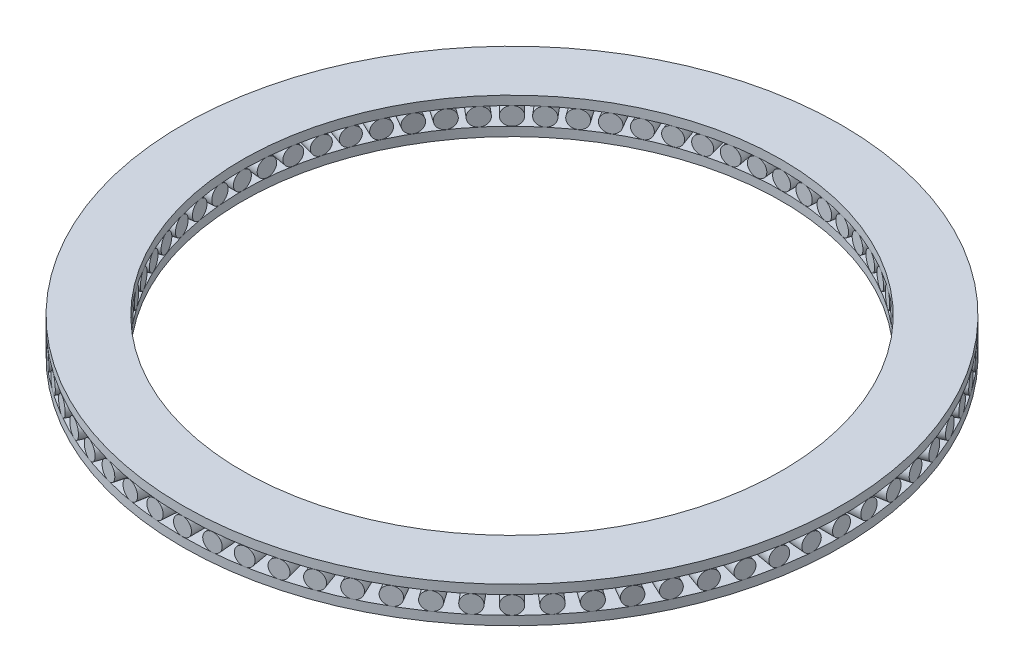
from build123d import *

# Parameters (mm, degrees)
SKETCH_1_R               = 55
SKETCH_1_R_2             = 45
EXTRUDE_1_DEPTH          = 1.5
EXTRUDE_START            = 45
SKETCH_2_R               = 1.5
EXTRUDE_2_DEPTH          = 10
PATTERN_CIRCULAR_3_COUNT = 72
EXTRUDE_START_2          = -4.5
SKETCH_3_R               = 55
SKETCH_3_R_2             = 45
EXTRUDE_3_DEPTH          = 1.5


with BuildPart() as part:
    # 草图1 → 凸台-拉伸1 (new body)
    with BuildSketch(Plane(origin=(0, 0, 0), x_dir=(1, 0, 0), z_dir=(0, 1, 0))):
        with Locations(Location((0, 0, 0), (0, 0, 270))):
            Circle(SKETCH_1_R)
        with Locations(Location((0, 0, 0), (0, 0, 270))):
            Circle(SKETCH_1_R_2, mode=Mode.SUBTRACT)
    extrude(amount=EXTRUDE_1_DEPTH)


with BuildPart() as body_2:
    # 草图2 → 凸台-拉伸2 (new body)
    with BuildSketch(Plane.XY.offset(EXTRUDE_START)):
        with Locations((0, 3)):
            Circle(SKETCH_2_R)
    extrude(amount=EXTRUDE_2_DEPTH)

    # 阵列(圆周)3: body 2 ×72 about axis
    pattern_circular_3_axis = Axis((0, 0, 0), (0, 1, 0))


with BuildPart() as body_2_1:
    add(body_2.part)
    for i in range(1, PATTERN_CIRCULAR_3_COUNT):
        add(body_2.part.rotate(pattern_circular_3_axis, i * 360 / PATTERN_CIRCULAR_3_COUNT))


with BuildPart() as body_3:
    # 草图3 → 凸台-拉伸3 (new body)
    with BuildSketch(Plane.XZ.offset(EXTRUDE_START_2)):
        with Locations(Location((0, 0, 0), (0, 0, 270))):
            Circle(SKETCH_3_R)
        with Locations(Location((0, 0, 0), (0, 0, 270))):
            Circle(SKETCH_3_R_2, mode=Mode.SUBTRACT)
    extrude(amount=-EXTRUDE_3_DEPTH)


solid = Compound([part.part, body_2_1.part, body_3.part])
